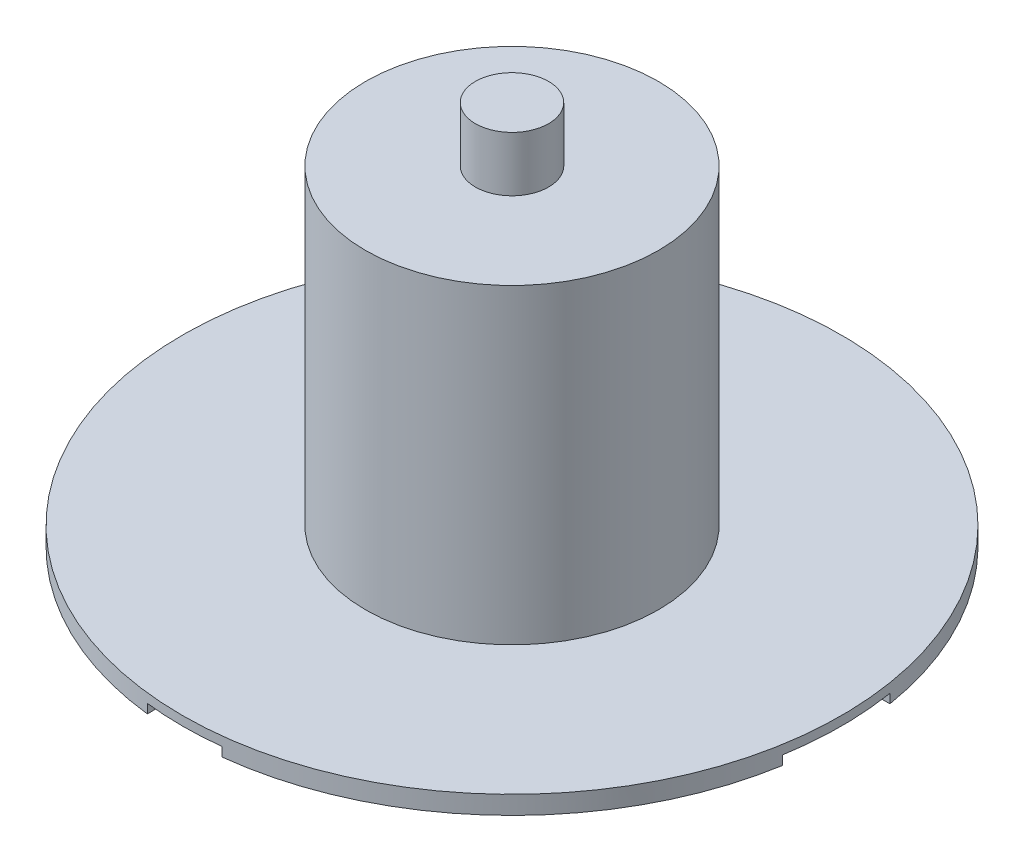
from build123d import *

# Parameters (mm, degrees)
SKETCH_1_R          = 18
EXTRUDE_1_DEPTH     = 1
SKETCH_2_R          = 8
EXTRUDE_2_DEPTH     = 17
SKETCH_3_R          = 2
EXTRUDE_3_DEPTH     = 3
SKETCH_4_R          = 5
CUT_EXTRUDE_1_DEPTH = 8
SKETCH_5_W          = 4.070351758
SKETCH_5_H          = 5.859394111
CUT_EXTRUDE_2_DEPTH = 0.5


with BuildPart() as part:
    # Эскиз1 → Бобышка-Вытянуть1 (new body)
    with BuildSketch(Plane(origin=(0, 0, 0), x_dir=(1, 0, 0), z_dir=(0, 1, 0))):
        with Locations(Location((0, 0, 0), (0, 0, 270))):
            Circle(SKETCH_1_R)
    extrude(amount=EXTRUDE_1_DEPTH)

    # Эскиз2 → Бобышка-Вытянуть2 (add)
    with BuildSketch(Plane(origin=(0, 1, 0), x_dir=(1, 0, 0), z_dir=(0, 1, 0))):
        with Locations(Location((0, 0, 0), (0, 0, 270))):
            Circle(SKETCH_2_R)
    extrude(amount=EXTRUDE_2_DEPTH)

    # Эскиз3 → Бобышка-Вытянуть3 (add)
    with BuildSketch(Plane(origin=(0, 18, 0), x_dir=(1, 0, 0), z_dir=(0, 1, 0))):
        with Locations(Location((0, 0, 0), (0, 0, 270))):
            Circle(SKETCH_3_R)
    extrude(amount=EXTRUDE_3_DEPTH)

    # Эскиз4 → Вырез-Вытянуть1 (cut)
    with BuildSketch(Plane.XZ):
        with Locations(Location((0, 0, 0), (0, 0, 270))):
            Circle(SKETCH_4_R)
    extrude(amount=-CUT_EXTRUDE_1_DEPTH, mode=Mode.SUBTRACT)

    # Эскиз5 → Вырез-Вытянуть2 (cut)
    with BuildSketch(Plane.XZ):
        with BuildLine():
            Line((-4.012728592, 2.982953109), (-17.751112381, 2.982953109))
            ThreePointArc((-17.751112381, 2.982953109), (-17.937670178, 1.496659138), (-18, 0))
            ThreePointArc((-18, 0), (-17.942077496, -1.442863516), (-17.768682764, -2.876441002))
            Line((-17.768682764, -2.876441002), (-4.089753924, -2.876441002))
            ThreePointArc((-4.089753924, -2.876441002), (-4.999568038, 0.065722391), (-4.012728592, 2.982953109))
        make_face()
        with BuildLine():
            ThreePointArc((18, 0), (17.937670178, 1.496659138), (17.751112381, 2.982953109))
            Line((17.751112381, 2.982953109), (4.012728592, 2.982953109))
            ThreePointArc((4.012728592, 2.982953109), (4.746769584, 1.571043768), (5, 0))
            ThreePointArc((5, 0), (4.767010049, -1.508514232), (4.089753924, -2.876441002))
            Line((4.089753924, -2.876441002), (17.768682764, -2.876441002))
            ThreePointArc((17.768682764, -2.876441002), (17.942077496, -1.442863516), (18, 0))
        make_face()
        with BuildLine():
            Line((-2.035175879, -2.876441002), (-2.035175879, 2.982953109))
            Line((-2.035175879, 2.982953109), (-4.012728592, 2.982953109))
            ThreePointArc((-4.012728592, 2.982953109), (-4.999568038, 0.065722391), (-4.089753924, -2.876441002))
            Line((-4.089753924, -2.876441002), (-2.035175879, -2.876441002))
        make_face()
        with BuildLine():
            Line((4.012728592, 2.982953109), (2.035175879, 2.982953109))
            Line((2.035175879, 2.982953109), (2.035175879, -2.876441002))
            Line((2.035175879, -2.876441002), (4.089753924, -2.876441002))
            ThreePointArc((4.089753924, -2.876441002), (4.767010049, -1.508514232), (5, 0))
            ThreePointArc((5, 0), (4.746769584, 1.571043768), (4.012728592, 2.982953109))
        make_face()
        with BuildLine():
            ThreePointArc((4.012728592, 2.982953109), (3.125961884, 3.902353431), (2.035175879, 4.567062419))
            Line((2.035175879, 4.567062419), (2.035175879, 2.982953109))
            Line((2.035175879, 2.982953109), (4.012728592, 2.982953109))
        make_face()
        with BuildLine():
            ThreePointArc((2.035175879, 4.567062419), (0, 5), (-2.035175879, 4.567062419))
            Line((-2.035175879, 4.567062419), (-2.035175879, 2.982953109))
            Line((-2.035175879, 2.982953109), (2.035175879, 2.982953109))
            Line((2.035175879, 2.982953109), (2.035175879, 4.567062419))
        make_face()
        with BuildLine():
            ThreePointArc((2.035175879, 17.884576012), (1.019223179, 17.971120836), (0, 18))
            ThreePointArc((0, 18), (-1.019223179, 17.971120836), (-2.035175879, 17.884576012))
            Line((-2.035175879, 17.884576012), (-2.035175879, 4.567062419))
            ThreePointArc((-2.035175879, 4.567062419), (0, 5), (2.035175879, 4.567062419))
            Line((2.035175879, 4.567062419), (2.035175879, 17.884576012))
        make_face()
        with BuildLine():
            ThreePointArc((2.035175879, -4.567062419), (0, -5), (-2.035175879, -4.567062419))
            Line((-2.035175879, -4.567062419), (-2.035175879, -17.884576012))
            ThreePointArc((-2.035175879, -17.884576012), (-1.019223179, -17.971120836), (0, -18))
            ThreePointArc((0, -18), (1.019223179, -17.971120836), (2.035175879, -17.884576012))
            Line((2.035175879, -17.884576012), (2.035175879, -4.567062419))
        make_face()
        with Locations((0, 0.053256054)):
            Rectangle(SKETCH_5_W, SKETCH_5_H)
        with BuildLine():
            Line((4.089753924, -2.876441002), (2.035175879, -2.876441002))
            Line((2.035175879, -2.876441002), (2.035175879, -4.567062419))
            ThreePointArc((2.035175879, -4.567062419), (3.176986224, -3.86092716), (4.089753924, -2.876441002))
        make_face()
        with BuildLine():
            Line((2.035175879, -2.876441002), (-2.035175879, -2.876441002))
            Line((-2.035175879, -2.876441002), (-2.035175879, -4.567062419))
            ThreePointArc((-2.035175879, -4.567062419), (0, -5), (2.035175879, -4.567062419))
            Line((2.035175879, -4.567062419), (2.035175879, -2.876441002))
        make_face()
        with BuildLine():
            Line((-2.035175879, -4.567062419), (-2.035175879, -2.876441002))
            Line((-2.035175879, -2.876441002), (-4.089753924, -2.876441002))
            ThreePointArc((-4.089753924, -2.876441002), (-3.176986224, -3.86092716), (-2.035175879, -4.567062419))
        make_face()
        with BuildLine():
            Line((-2.035175879, 2.982953109), (-2.035175879, 4.567062419))
            ThreePointArc((-2.035175879, 4.567062419), (-3.125961884, 3.902353431), (-4.012728592, 2.982953109))
            Line((-4.012728592, 2.982953109), (-2.035175879, 2.982953109))
        make_face()
    extrude(amount=-CUT_EXTRUDE_2_DEPTH, mode=Mode.SUBTRACT)


solid = part.part
